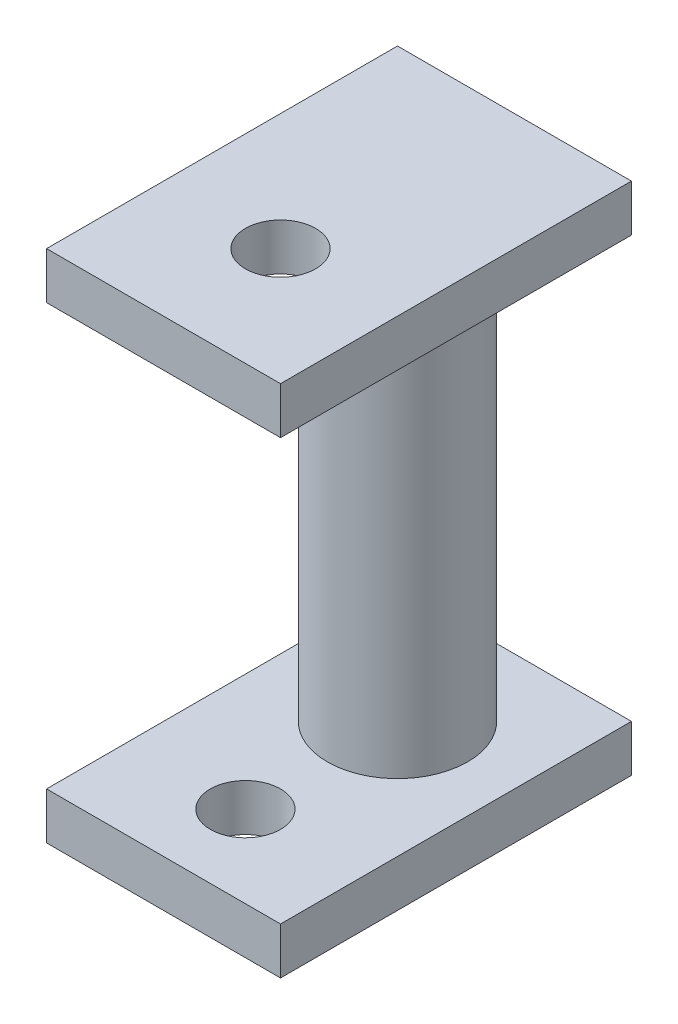
from build123d import *

# Parameters (mm, degrees)
SKETCH_1_W      = 10
SKETCH_1_H      = 15
SKETCH_1_R      = 1.5
EXTRUDE_2_DEPTH = 2
SKETCH_2_R      = 3
EXTRUDE_3_DEPTH = 20
SKETCH_3_W      = 10
SKETCH_3_H      = 15
SKETCH_3_R      = 1.5
EXTRUDE_4_DEPTH = 2


with BuildPart() as part:
    # 草图1 → 凸台-拉伸2 (new body)
    with BuildSketch(Plane(origin=(0, 0, 0), x_dir=(1, 0, 0), z_dir=(0, 1, 0))):
        with Locations((0, -2.5)):
            Rectangle(SKETCH_1_W, SKETCH_1_H)
        with Locations(Location((0, -6.5, 0), (0, 0, 270))):
            Circle(SKETCH_1_R, mode=Mode.SUBTRACT)
    extrude(amount=EXTRUDE_2_DEPTH)

    # 草图2 → 凸台-拉伸3 (add)
    with BuildSketch(Plane(origin=(0, 2, 0), x_dir=(1, 0, 0), z_dir=(0, 1, 0))):
        with Locations(Location((0, 0, 0), (0, 0, 270))):
            Circle(SKETCH_2_R)
    extrude(amount=EXTRUDE_3_DEPTH)

    # 草图3 → 凸台-拉伸4 (add)
    with BuildSketch(Plane(origin=(0, 22, 0), x_dir=(1, 0, 0), z_dir=(0, 1, 0))):
        with Locations((0, -2.5)):
            Rectangle(SKETCH_3_W, SKETCH_3_H)
        with Locations(Location((0, -5, 0), (0, 0, 270))):
            Circle(SKETCH_3_R, mode=Mode.SUBTRACT)
    extrude(amount=-EXTRUDE_4_DEPTH)


solid = part.part
